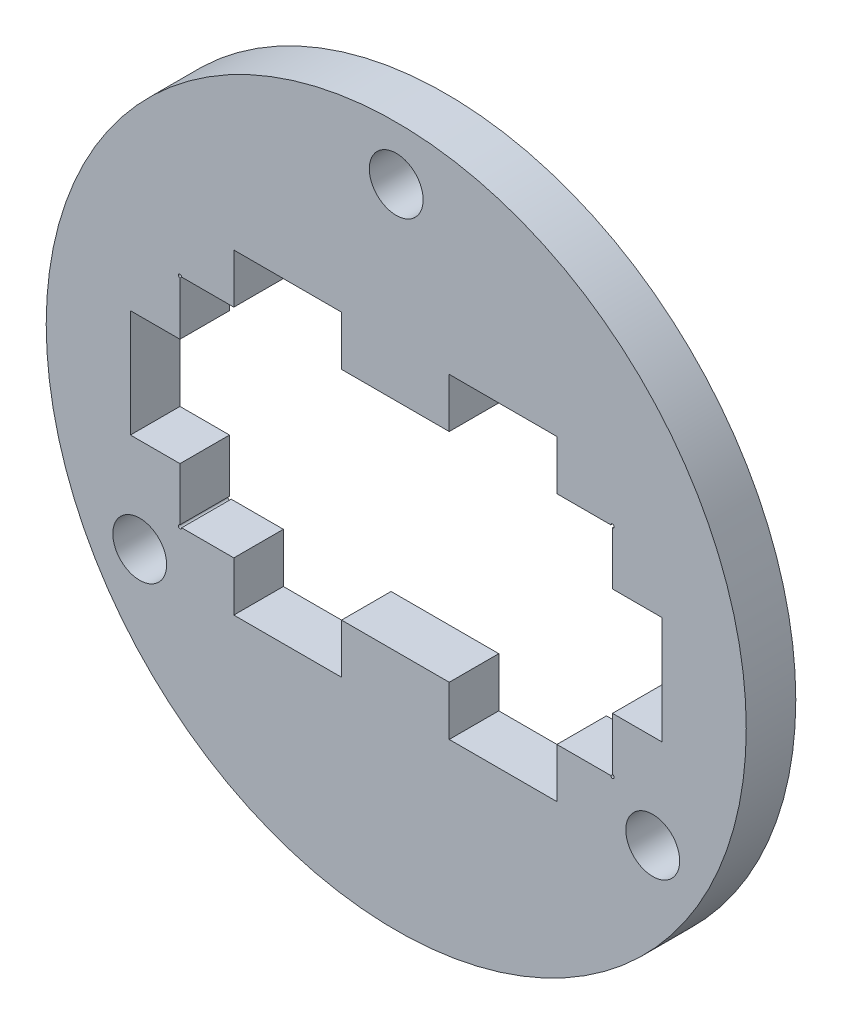
from build123d import *

# Parameters (mm, degrees)
SKETCH1_R           = 41.275
SKETCH1_R_2         = 3.175
BOSS_EXTRUDE1_DEPTH = 5.842
SKETCH7_R           = 41.275
SKETCH7_R_2         = 39.487499946
CUT_EXTRUDE3_DEPTH  = 59.663278241
SKETCH8_W           = 5.842
SKETCH8_H           = 12.7
SKETCH8_W_2         = 12.7
SKETCH8_H_2         = 5.842
CUT_EXTRUDE4_DEPTH  = 57.148501921
SKETCH9_R           = 41.275
SKETCH9_R_2         = 39.487499946
BOSS_EXTRUDE2_DEPTH = 5.842


with BuildPart() as part:
    # Sketch1 → Boss-Extrude1 (new body)
    with BuildSketch(Plane.XY):
        Circle(SKETCH1_R)
        with Locations((0, 34.925)):
            Circle(SKETCH1_R_2, mode=Mode.SUBTRACT)
        with Locations((30.245937227, -17.4625)):
            Circle(SKETCH1_R_2, mode=Mode.SUBTRACT)
        with Locations((-30.245937227, -17.4625)):
            Circle(SKETCH1_R_2, mode=Mode.SUBTRACT)
        with BuildLine():
            Line((-25.3015625, -12.8), (25.3015625, -12.8))
            ThreePointArc((25.3015625, -12.8), (25.640316502, -12.940316502), (25.5, -12.6015625))
            Line((25.5, -12.6015625), (25.5, 12.6015625))
            ThreePointArc((25.5, 12.6015625), (25.640316502, 12.940316502), (25.3015625, 12.8))
            Line((25.3015625, 12.8), (-25.3015625, 12.8))
            ThreePointArc((-25.3015625, 12.8), (-25.640316502, 12.940316502), (-25.5, 12.6015625))
            Line((-25.5, 12.6015625), (-25.5, -12.6015625))
            ThreePointArc((-25.5, -12.6015625), (-25.640316502, -12.940316502), (-25.3015625, -12.8))
        make_face(mode=Mode.SUBTRACT)
    extrude(amount=BOSS_EXTRUDE1_DEPTH)

    # Sketch7 → Cut-Extrude3 (cut, through all)
    with BuildSketch(Plane(origin=(0, 0, 0), x_dir=(-1, 0, 0), z_dir=(0, 0, -1))):
        Circle(SKETCH7_R)
        Circle(SKETCH7_R_2, mode=Mode.SUBTRACT)
    extrude(amount=-CUT_EXTRUDE3_DEPTH, mode=Mode.SUBTRACT)

    # Sketch8 → Cut-Extrude4 (cut, through all)
    with BuildSketch(Plane(origin=(0, 0, 0), x_dir=(-1, 0, 0), z_dir=(0, 0, -1))):
        with Locations((-28.421, 0)):
            Rectangle(SKETCH8_W, SKETCH8_H)
        with Locations((-12.599996942, 15.721)):
            Rectangle(SKETCH8_W_2, SKETCH8_H_2)
        with Locations((12.800003058, 15.721)):
            Rectangle(SKETCH8_W_2, SKETCH8_H_2)
        with Locations((12.800003058, -15.721)):
            Rectangle(SKETCH8_W_2, SKETCH8_H_2)
        with Locations((-12.599996942, -15.721)):
            Rectangle(SKETCH8_W_2, SKETCH8_H_2)
        with Locations((28.421, 0)):
            Rectangle(SKETCH8_W, SKETCH8_H)
    extrude(amount=-CUT_EXTRUDE4_DEPTH, mode=Mode.SUBTRACT)

    # Sketch9 → Boss-Extrude2 (add)
    with BuildSketch(Plane(origin=(0, 0, 0), x_dir=(-1, 0, 0), z_dir=(0, 0, -1))):
        Circle(SKETCH9_R)
        Circle(SKETCH9_R_2, mode=Mode.SUBTRACT)
    extrude(amount=-BOSS_EXTRUDE2_DEPTH)


solid = part.part
